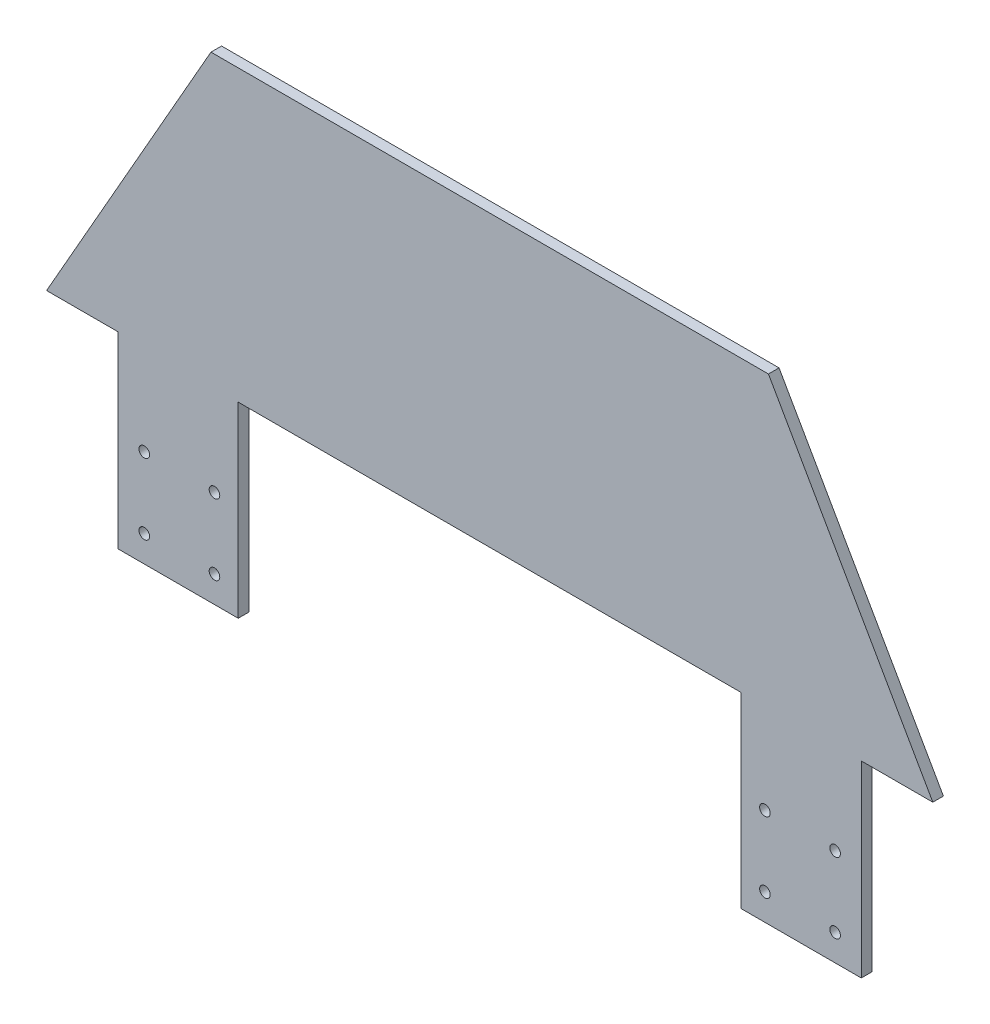
from build123d import *

# Parameters (mm, degrees)
SKETCH_1_W          = 322.893717544
SKETCH_1_H          = 176.219773954
EXTRUDE_1_DEPTH     = 3
SKETCH_2_W          = 142.4
SKETCH_2_H          = 35
SKETCH_2_W_2        = 112.493717544
SKETCH_2_H_2        = 176.219773954
CUT_EXTRUDE_1_DEPTH = 3
SKETCH_4_W          = 142.4
SKETCH_4_H          = 18
CUT_EXTRUDE_2_DEPTH = 184.949559365
SKETCH_14_R         = 1.5
CUT_EXTRUDE_4_DEPTH = 184.949559365
EXTRUDE_3_DEPTH     = 3
CUT_EXTRUDE_5_DEPTH = 202.958956474
CUT_EXTRUDE_6_DEPTH = 202.958956474


with BuildPart() as part:
    # 草图1 → 凸台-拉伸1 (new body)
    with BuildSketch(Plane.XY):
        Rectangle(SKETCH_1_W, SKETCH_1_H)
    extrude(amount=EXTRUDE_1_DEPTH)

    # 草图2 → 切除-拉伸1 (cut)
    with BuildSketch(Plane.XY.offset(3)):
        with Locations((56.246858772, -70.609886977)):
            Rectangle(SKETCH_2_W, SKETCH_2_H)
        with Locations((-105.2, 0)):
            Rectangle(SKETCH_2_W_2, SKETCH_2_H_2)
    extrude(amount=-CUT_EXTRUDE_1_DEPTH, mode=Mode.SUBTRACT)

    # 草图4 → 切除-拉伸2 (cut, through all)
    with BuildSketch(Plane.XY.offset(3)):
        with Locations((56.246858772, -44.109886977)):
            Rectangle(SKETCH_4_W, SKETCH_4_H)
    extrude(amount=-CUT_EXTRUDE_2_DEPTH, mode=Mode.SUBTRACT)

    # 草图14 → 切除-拉伸4 (cut, through all)
    with BuildSketch(Plane.XY.offset(3)):
        with Locations((154.040490147, -60.609886977)):
            Circle(SKETCH_14_R)
        with Locations((154.040490147, -80.609886977)):
            Circle(SKETCH_14_R)
        with Locations((134.171700532, -60.609886977)):
            Circle(SKETCH_14_R)
        with Locations((134.171700532, -80.609886977)):
            Circle(SKETCH_14_R)
        with Locations((-21.677982988, -60.609886977)):
            Circle(SKETCH_14_R)
        with Locations((-21.677982988, -80.609886977)):
            Circle(SKETCH_14_R)
        with Locations((-41.546772603, -60.609886977)):
            Circle(SKETCH_14_R)
        with Locations((-41.546772603, -80.609886977)):
            Circle(SKETCH_14_R)
    extrude(amount=-CUT_EXTRUDE_4_DEPTH, mode=Mode.SUBTRACT)

    # 草图19 → 凸台-拉伸3 (add)
    with BuildSketch(Plane.XY.offset(3)):
        Polygon((-48.953141228, -34.8815165), (-48.953141228, 3.544050126), (-69.206772046, -34.8815165), align=None)
        Polygon((161.446858772, 3.544050126), (161.446858772, -34.8815165), (181.70048959, -34.8815165), align=None)
    extrude(amount=-EXTRUDE_3_DEPTH)

    # 草图20 → 切除-拉伸5 (cut, through all)
    with BuildSketch(Plane.XY.offset(3)):
        Polygon((-48.953141228, 3.544050126), (-48.953141228, 88.109886977), (161.446858772, 88.109886977), (161.446858772, 3.544050126), (138.622177289, 46.847462087), (-26.128459745, 46.847462087), align=None)
    extrude(amount=-CUT_EXTRUDE_5_DEPTH, mode=Mode.SUBTRACT)

    # 草图21 → 切除-拉伸6 (cut, through all)
    with BuildSketch(Plane.XY.offset(3)):
        Polygon((-69.206772046, -34.8815165), (-22.62920761, 46.919811864), (-26.128459745, 46.847462087), align=None)
        Polygon((181.70048959, -34.8815165), (135.122177289, 46.919811864), (138.622177289, 46.847462087), align=None)
    extrude(amount=-CUT_EXTRUDE_6_DEPTH, mode=Mode.SUBTRACT)


solid = part.part
